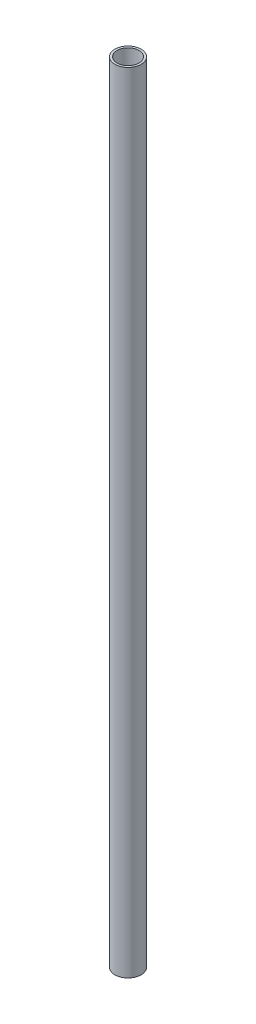
from build123d import *

# Parameters (mm, degrees)
SKETCH_1_R      = 3
SKETCH_1_R_2    = 2.5
EXTRUDE_1_DEPTH = 180


with BuildPart() as part:
    # 草图1 → 凸台-拉伸1 (new body)
    with BuildSketch(Plane(origin=(0, 0, 0), x_dir=(1, 0, 0), z_dir=(0, 1, 0))):
        with Locations(Location((0, 0, 0), (0, 0, 90))):
            Circle(SKETCH_1_R)
        with Locations(Location((0, 0, 0), (0, 0, 90))):
            Circle(SKETCH_1_R_2, mode=Mode.SUBTRACT)
    extrude(amount=EXTRUDE_1_DEPTH)


solid = part.part
